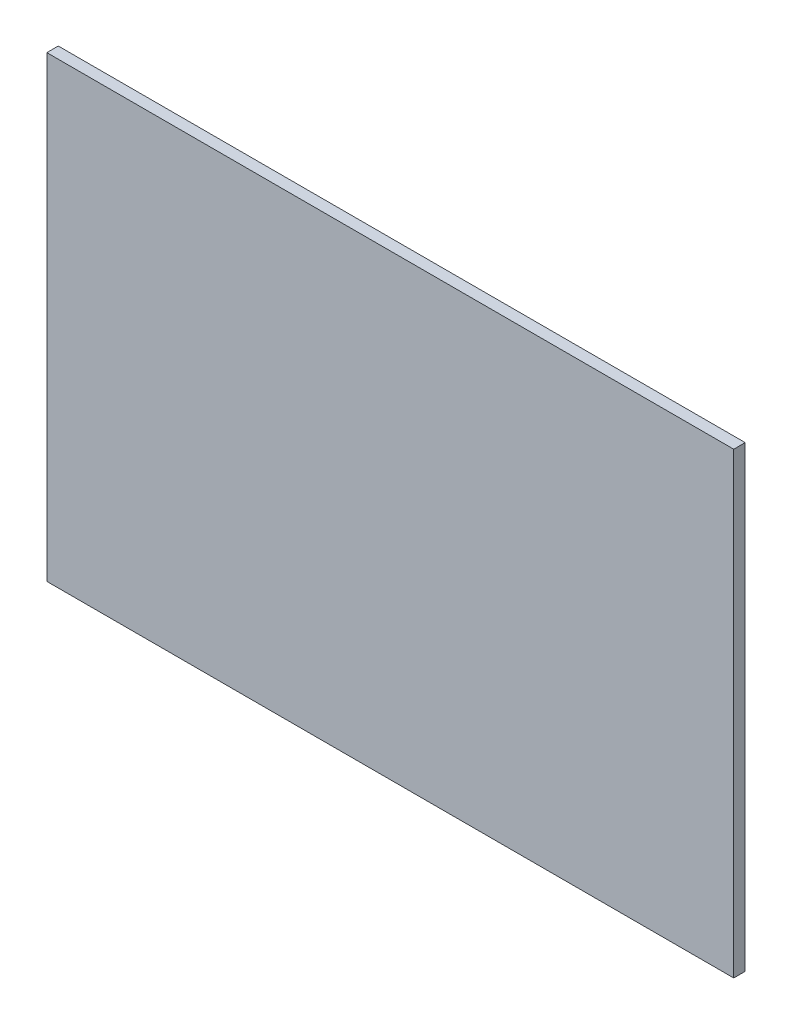
from build123d import *

# Parameters (mm, degrees)
SKETCH1_W           = 600
SKETCH1_H           = 400
BOSS_EXTRUDE1_DEPTH = 10


with BuildPart() as part:
    # Sketch1 → Boss-Extrude1 (new body)
    with BuildSketch(Plane.XY):
        Rectangle(SKETCH1_W, SKETCH1_H)
    extrude(amount=BOSS_EXTRUDE1_DEPTH)


solid = part.part
